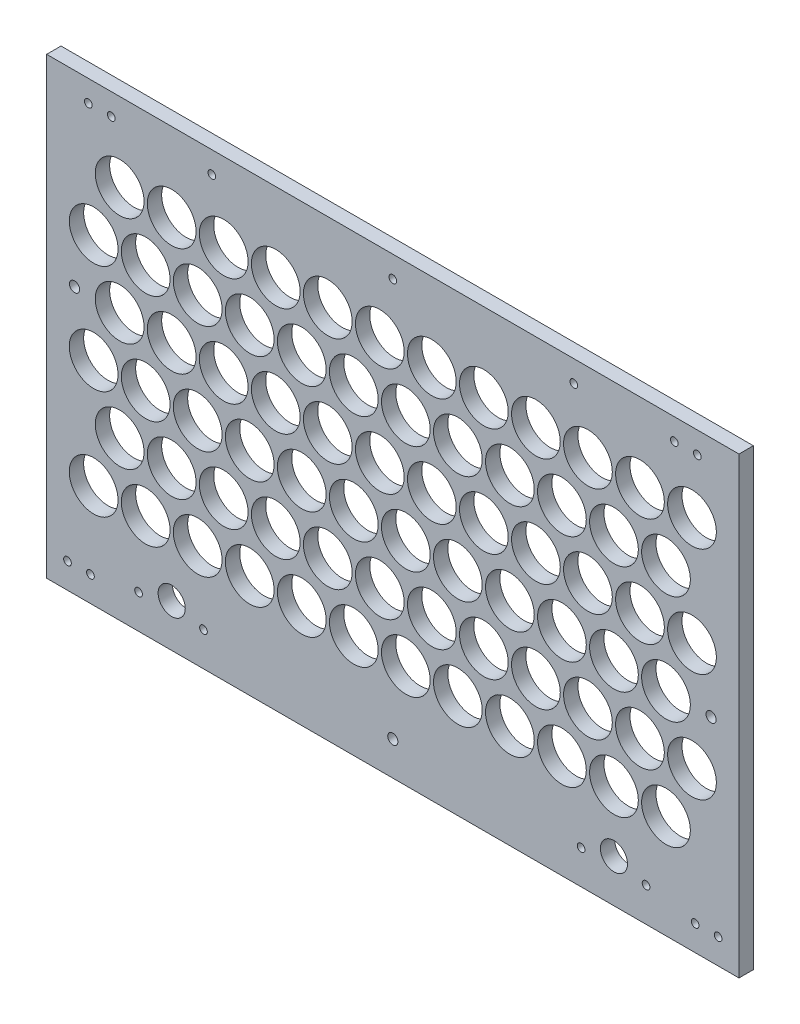
from build123d import *

# Parameters (mm, degrees)
SKETCH1_W                  = 306.05000007
SKETCH1_H                  = 197.4250001
BOSS_EXTRUDE1_DEPTH        = 6.35
SKETCH3_R                  = 10.775
CUT_EXTRUDE1_DEPTH         = 187.132543615
SKETCH4_R                  = 10.775
CUT_EXTRUDE2_DEPTH         = 187.132543615
LPATTERN1_COUNT            = 12
LPATTERN1_PITCH            = 23
LPATTERN2_COUNT            = 3
LPATTERN2_PITCH            = 48
LPATTERN2_COPY_1_SKETCH_R  = 10.775
LPATTERN2_COPY_1_DEPTH     = 187.132543615
LPATTERN2_COPY_2_SKETCH_R  = 10.775
LPATTERN2_COPY_2_DEPTH     = 187.132543615
LPATTERN2_COPY_3_SKETCH_R  = 10.775
LPATTERN2_COPY_3_DEPTH     = 187.132543615
LPATTERN2_COPY_4_SKETCH_R  = 10.775
LPATTERN2_COPY_4_DEPTH     = 187.132543615
LPATTERN2_COPY_5_SKETCH_R  = 10.775
LPATTERN2_COPY_5_DEPTH     = 187.132543615
LPATTERN2_COPY_6_SKETCH_R  = 10.775
LPATTERN2_COPY_6_DEPTH     = 187.132543615
LPATTERN2_COPY_7_SKETCH_R  = 10.775
LPATTERN2_COPY_7_DEPTH     = 187.132543615
LPATTERN2_COPY_8_SKETCH_R  = 10.775
LPATTERN2_COPY_8_DEPTH     = 187.132543615
LPATTERN2_COPY_9_SKETCH_R  = 10.775
LPATTERN2_COPY_9_DEPTH     = 187.132543615
LPATTERN2_COPY_10_SKETCH_R = 10.775
LPATTERN2_COPY_10_DEPTH    = 187.132543615
LPATTERN2_COPY_11_SKETCH_R = 10.775
LPATTERN2_COPY_11_DEPTH    = 187.132543615
LPATTERN2_COPY_12_SKETCH_R = 10.775
LPATTERN2_COPY_12_DEPTH    = 187.132543615
LPATTERN2_COPY_13_SKETCH_R = 10.775
LPATTERN2_COPY_13_DEPTH    = 187.132543615
LPATTERN2_COPY_14_SKETCH_R = 10.775
LPATTERN2_COPY_14_DEPTH    = 187.132543615
LPATTERN2_COPY_15_SKETCH_R = 10.775
LPATTERN2_COPY_15_DEPTH    = 187.132543615
LPATTERN2_COPY_16_SKETCH_R = 10.775
LPATTERN2_COPY_16_DEPTH    = 187.132543615
LPATTERN2_COPY_17_SKETCH_R = 10.775
LPATTERN2_COPY_17_DEPTH    = 187.132543615
LPATTERN2_COPY_18_SKETCH_R = 10.775
LPATTERN2_COPY_18_DEPTH    = 187.132543615
LPATTERN2_COPY_19_SKETCH_R = 10.775
LPATTERN2_COPY_19_DEPTH    = 187.132543615
LPATTERN2_COPY_20_SKETCH_R = 10.775
LPATTERN2_COPY_20_DEPTH    = 187.132543615
LPATTERN2_COPY_21_SKETCH_R = 10.775
LPATTERN2_COPY_21_DEPTH    = 187.132543615
LPATTERN2_COPY_22_SKETCH_R = 10.775
LPATTERN2_COPY_22_DEPTH    = 187.132543615
LPATTERN2_COPY_23_SKETCH_R = 10.775
LPATTERN2_COPY_23_DEPTH    = 187.132543615
LPATTERN2_COPY_24_SKETCH_R = 10.775
LPATTERN2_COPY_24_DEPTH    = 187.132543615
LPATTERN2_COPY_25_SKETCH_R = 10.775
LPATTERN2_COPY_25_DEPTH    = 187.132543615
LPATTERN2_COPY_26_SKETCH_R = 10.775
LPATTERN2_COPY_26_DEPTH    = 187.132543615
LPATTERN2_COPY_27_SKETCH_R = 10.775
LPATTERN2_COPY_27_DEPTH    = 187.132543615
LPATTERN2_COPY_28_SKETCH_R = 10.775
LPATTERN2_COPY_28_DEPTH    = 187.132543615
LPATTERN2_COPY_29_SKETCH_R = 10.775
LPATTERN2_COPY_29_DEPTH    = 187.132543615
LPATTERN2_COPY_30_SKETCH_R = 10.775
LPATTERN2_COPY_30_DEPTH    = 187.132543615
LPATTERN2_COPY_31_SKETCH_R = 10.775
LPATTERN2_COPY_31_DEPTH    = 187.132543615
LPATTERN2_COPY_32_SKETCH_R = 10.775
LPATTERN2_COPY_32_DEPTH    = 187.132543615
LPATTERN2_COPY_33_SKETCH_R = 10.775
LPATTERN2_COPY_33_DEPTH    = 187.132543615
LPATTERN2_COPY_34_SKETCH_R = 10.775
LPATTERN2_COPY_34_DEPTH    = 187.132543615
LPATTERN2_COPY_35_SKETCH_R = 10.775
LPATTERN2_COPY_35_DEPTH    = 187.132543615
LPATTERN2_COPY_36_SKETCH_R = 10.775
LPATTERN2_COPY_36_DEPTH    = 187.132543615
LPATTERN2_COPY_37_SKETCH_R = 10.775
LPATTERN2_COPY_37_DEPTH    = 187.132543615
LPATTERN2_COPY_38_SKETCH_R = 10.775
LPATTERN2_COPY_38_DEPTH    = 187.132543615
LPATTERN2_COPY_39_SKETCH_R = 10.775
LPATTERN2_COPY_39_DEPTH    = 187.132543615
LPATTERN2_COPY_40_SKETCH_R = 10.775
LPATTERN2_COPY_40_DEPTH    = 187.132543615
LPATTERN2_COPY_41_SKETCH_R = 10.775
LPATTERN2_COPY_41_DEPTH    = 187.132543615
LPATTERN2_COPY_42_SKETCH_R = 10.775
LPATTERN2_COPY_42_DEPTH    = 187.132543615
LPATTERN2_COPY_43_SKETCH_R = 10.775
LPATTERN2_COPY_43_DEPTH    = 187.132543615
LPATTERN2_COPY_44_SKETCH_R = 10.775
LPATTERN2_COPY_44_DEPTH    = 187.132543615
SKETCH13_W                 = 306.05000007
SKETCH13_H                 = 6.35
BOSS_EXTRUDE2_DEPTH        = 3.175
SKETCH14_R                 = 6
CUT_EXTRUDE3_DEPTH         = 187.132543615
M3_CLEARANCE_HOLE1_D       = 3.4
SKETCH17_R                 = 2.25
CUT_EXTRUDE4_DEPTH         = 187.132543615


with BuildPart() as part:
    # Sketch1 → Boss-Extrude1 (new body)
    with BuildSketch(Plane.XY):
        with Locations((3.5e-08, -7.06250005)):
            Rectangle(SKETCH1_W, SKETCH1_H)
    extrude(amount=BOSS_EXTRUDE1_DEPTH)

    # Sketch3 → Cut-Extrude1 (cut, through all)
    with BuildSketch(Plane.XY.offset(6.35)):
        with Locations((-132.25, -60)):
            Circle(SKETCH3_R)
    cut_extrude1 = extrude(amount=-CUT_EXTRUDE1_DEPTH, mode=Mode.SUBTRACT)

    # Sketch4 → Cut-Extrude2 (cut, through all)
    with BuildSketch(Plane.XY.offset(6.35)):
        with Locations((-120.75, -36)):
            Circle(SKETCH4_R)
    cut_extrude2 = extrude(amount=-CUT_EXTRUDE2_DEPTH, mode=Mode.SUBTRACT)

    # LPattern1: Cut-Extrude1, Cut-Extrude2 ×12
    with Locations(*[(i * LPATTERN1_PITCH, 0, 0) for i in range(1, LPATTERN1_COUNT)]):
        add(cut_extrude1, mode=Mode.SUBTRACT)
        add(cut_extrude2, mode=Mode.SUBTRACT)

    # LPattern2: Cut-Extrude1, Cut-Extrude2 ×3
    with Locations(*[(0, i * LPATTERN2_PITCH, 0) for i in range(1, LPATTERN2_COUNT)]):
        add(cut_extrude1, mode=Mode.SUBTRACT)
        add(cut_extrude2, mode=Mode.SUBTRACT)

    # LPattern2 copy 1 sketch → LPattern2 copy 1 (cut, through all)
    with BuildSketch(Plane(origin=(23, 48, 6.35), x_dir=(1, 0, 0), z_dir=(0, 0, 1))):
        with Locations((-132.25, -60)):
            Circle(LPATTERN2_COPY_1_SKETCH_R)
    extrude(amount=-LPATTERN2_COPY_1_DEPTH, mode=Mode.SUBTRACT)

    # LPattern2 copy 2 sketch → LPattern2 copy 2 (cut, through all)
    with BuildSketch(Plane(origin=(23, 96, 6.35), x_dir=(1, 0, 0), z_dir=(0, 0, 1))):
        with Locations((-132.25, -60)):
            Circle(LPATTERN2_COPY_2_SKETCH_R)
    extrude(amount=-LPATTERN2_COPY_2_DEPTH, mode=Mode.SUBTRACT)

    # LPattern2 copy 3 sketch → LPattern2 copy 3 (cut, through all)
    with BuildSketch(Plane(origin=(46, 48, 6.35), x_dir=(1, 0, 0), z_dir=(0, 0, 1))):
        with Locations((-132.25, -60)):
            Circle(LPATTERN2_COPY_3_SKETCH_R)
    extrude(amount=-LPATTERN2_COPY_3_DEPTH, mode=Mode.SUBTRACT)

    # LPattern2 copy 4 sketch → LPattern2 copy 4 (cut, through all)
    with BuildSketch(Plane(origin=(46, 96, 6.35), x_dir=(1, 0, 0), z_dir=(0, 0, 1))):
        with Locations((-132.25, -60)):
            Circle(LPATTERN2_COPY_4_SKETCH_R)
    extrude(amount=-LPATTERN2_COPY_4_DEPTH, mode=Mode.SUBTRACT)

    # LPattern2 copy 5 sketch → LPattern2 copy 5 (cut, through all)
    with BuildSketch(Plane(origin=(69, 48, 6.35), x_dir=(1, 0, 0), z_dir=(0, 0, 1))):
        with Locations((-132.25, -60)):
            Circle(LPATTERN2_COPY_5_SKETCH_R)
    extrude(amount=-LPATTERN2_COPY_5_DEPTH, mode=Mode.SUBTRACT)

    # LPattern2 copy 6 sketch → LPattern2 copy 6 (cut, through all)
    with BuildSketch(Plane(origin=(69, 96, 6.35), x_dir=(1, 0, 0), z_dir=(0, 0, 1))):
        with Locations((-132.25, -60)):
            Circle(LPATTERN2_COPY_6_SKETCH_R)
    extrude(amount=-LPATTERN2_COPY_6_DEPTH, mode=Mode.SUBTRACT)

    # LPattern2 copy 7 sketch → LPattern2 copy 7 (cut, through all)
    with BuildSketch(Plane(origin=(92, 48, 6.35), x_dir=(1, 0, 0), z_dir=(0, 0, 1))):
        with Locations((-132.25, -60)):
            Circle(LPATTERN2_COPY_7_SKETCH_R)
    extrude(amount=-LPATTERN2_COPY_7_DEPTH, mode=Mode.SUBTRACT)

    # LPattern2 copy 8 sketch → LPattern2 copy 8 (cut, through all)
    with BuildSketch(Plane(origin=(92, 96, 6.35), x_dir=(1, 0, 0), z_dir=(0, 0, 1))):
        with Locations((-132.25, -60)):
            Circle(LPATTERN2_COPY_8_SKETCH_R)
    extrude(amount=-LPATTERN2_COPY_8_DEPTH, mode=Mode.SUBTRACT)

    # LPattern2 copy 9 sketch → LPattern2 copy 9 (cut, through all)
    with BuildSketch(Plane(origin=(115, 48, 6.35), x_dir=(1, 0, 0), z_dir=(0, 0, 1))):
        with Locations((-132.25, -60)):
            Circle(LPATTERN2_COPY_9_SKETCH_R)
    extrude(amount=-LPATTERN2_COPY_9_DEPTH, mode=Mode.SUBTRACT)

    # LPattern2 copy 10 sketch → LPattern2 copy 10 (cut, through all)
    with BuildSketch(Plane(origin=(115, 96, 6.35), x_dir=(1, 0, 0), z_dir=(0, 0, 1))):
        with Locations((-132.25, -60)):
            Circle(LPATTERN2_COPY_10_SKETCH_R)
    extrude(amount=-LPATTERN2_COPY_10_DEPTH, mode=Mode.SUBTRACT)

    # LPattern2 copy 11 sketch → LPattern2 copy 11 (cut, through all)
    with BuildSketch(Plane(origin=(138, 48, 6.35), x_dir=(1, 0, 0), z_dir=(0, 0, 1))):
        with Locations((-132.25, -60)):
            Circle(LPATTERN2_COPY_11_SKETCH_R)
    extrude(amount=-LPATTERN2_COPY_11_DEPTH, mode=Mode.SUBTRACT)

    # LPattern2 copy 12 sketch → LPattern2 copy 12 (cut, through all)
    with BuildSketch(Plane(origin=(138, 96, 6.35), x_dir=(1, 0, 0), z_dir=(0, 0, 1))):
        with Locations((-132.25, -60)):
            Circle(LPATTERN2_COPY_12_SKETCH_R)
    extrude(amount=-LPATTERN2_COPY_12_DEPTH, mode=Mode.SUBTRACT)

    # LPattern2 copy 13 sketch → LPattern2 copy 13 (cut, through all)
    with BuildSketch(Plane(origin=(161, 48, 6.35), x_dir=(1, 0, 0), z_dir=(0, 0, 1))):
        with Locations((-132.25, -60)):
            Circle(LPATTERN2_COPY_13_SKETCH_R)
    extrude(amount=-LPATTERN2_COPY_13_DEPTH, mode=Mode.SUBTRACT)

    # LPattern2 copy 14 sketch → LPattern2 copy 14 (cut, through all)
    with BuildSketch(Plane(origin=(161, 96, 6.35), x_dir=(1, 0, 0), z_dir=(0, 0, 1))):
        with Locations((-132.25, -60)):
            Circle(LPATTERN2_COPY_14_SKETCH_R)
    extrude(amount=-LPATTERN2_COPY_14_DEPTH, mode=Mode.SUBTRACT)

    # LPattern2 copy 15 sketch → LPattern2 copy 15 (cut, through all)
    with BuildSketch(Plane(origin=(184, 48, 6.35), x_dir=(1, 0, 0), z_dir=(0, 0, 1))):
        with Locations((-132.25, -60)):
            Circle(LPATTERN2_COPY_15_SKETCH_R)
    extrude(amount=-LPATTERN2_COPY_15_DEPTH, mode=Mode.SUBTRACT)

    # LPattern2 copy 16 sketch → LPattern2 copy 16 (cut, through all)
    with BuildSketch(Plane(origin=(184, 96, 6.35), x_dir=(1, 0, 0), z_dir=(0, 0, 1))):
        with Locations((-132.25, -60)):
            Circle(LPATTERN2_COPY_16_SKETCH_R)
    extrude(amount=-LPATTERN2_COPY_16_DEPTH, mode=Mode.SUBTRACT)

    # LPattern2 copy 17 sketch → LPattern2 copy 17 (cut, through all)
    with BuildSketch(Plane(origin=(207, 48, 6.35), x_dir=(1, 0, 0), z_dir=(0, 0, 1))):
        with Locations((-132.25, -60)):
            Circle(LPATTERN2_COPY_17_SKETCH_R)
    extrude(amount=-LPATTERN2_COPY_17_DEPTH, mode=Mode.SUBTRACT)

    # LPattern2 copy 18 sketch → LPattern2 copy 18 (cut, through all)
    with BuildSketch(Plane(origin=(207, 96, 6.35), x_dir=(1, 0, 0), z_dir=(0, 0, 1))):
        with Locations((-132.25, -60)):
            Circle(LPATTERN2_COPY_18_SKETCH_R)
    extrude(amount=-LPATTERN2_COPY_18_DEPTH, mode=Mode.SUBTRACT)

    # LPattern2 copy 19 sketch → LPattern2 copy 19 (cut, through all)
    with BuildSketch(Plane(origin=(230, 48, 6.35), x_dir=(1, 0, 0), z_dir=(0, 0, 1))):
        with Locations((-132.25, -60)):
            Circle(LPATTERN2_COPY_19_SKETCH_R)
    extrude(amount=-LPATTERN2_COPY_19_DEPTH, mode=Mode.SUBTRACT)

    # LPattern2 copy 20 sketch → LPattern2 copy 20 (cut, through all)
    with BuildSketch(Plane(origin=(230, 96, 6.35), x_dir=(1, 0, 0), z_dir=(0, 0, 1))):
        with Locations((-132.25, -60)):
            Circle(LPATTERN2_COPY_20_SKETCH_R)
    extrude(amount=-LPATTERN2_COPY_20_DEPTH, mode=Mode.SUBTRACT)

    # LPattern2 copy 21 sketch → LPattern2 copy 21 (cut, through all)
    with BuildSketch(Plane(origin=(253, 48, 6.35), x_dir=(1, 0, 0), z_dir=(0, 0, 1))):
        with Locations((-132.25, -60)):
            Circle(LPATTERN2_COPY_21_SKETCH_R)
    extrude(amount=-LPATTERN2_COPY_21_DEPTH, mode=Mode.SUBTRACT)

    # LPattern2 copy 22 sketch → LPattern2 copy 22 (cut, through all)
    with BuildSketch(Plane(origin=(253, 96, 6.35), x_dir=(1, 0, 0), z_dir=(0, 0, 1))):
        with Locations((-132.25, -60)):
            Circle(LPATTERN2_COPY_22_SKETCH_R)
    extrude(amount=-LPATTERN2_COPY_22_DEPTH, mode=Mode.SUBTRACT)

    # LPattern2 copy 23 sketch → LPattern2 copy 23 (cut, through all)
    with BuildSketch(Plane(origin=(23, 48, 6.35), x_dir=(1, 0, 0), z_dir=(0, 0, 1))):
        with Locations((-120.75, -36)):
            Circle(LPATTERN2_COPY_23_SKETCH_R)
    extrude(amount=-LPATTERN2_COPY_23_DEPTH, mode=Mode.SUBTRACT)

    # LPattern2 copy 24 sketch → LPattern2 copy 24 (cut, through all)
    with BuildSketch(Plane(origin=(23, 96, 6.35), x_dir=(1, 0, 0), z_dir=(0, 0, 1))):
        with Locations((-120.75, -36)):
            Circle(LPATTERN2_COPY_24_SKETCH_R)
    extrude(amount=-LPATTERN2_COPY_24_DEPTH, mode=Mode.SUBTRACT)

    # LPattern2 copy 25 sketch → LPattern2 copy 25 (cut, through all)
    with BuildSketch(Plane(origin=(46, 48, 6.35), x_dir=(1, 0, 0), z_dir=(0, 0, 1))):
        with Locations((-120.75, -36)):
            Circle(LPATTERN2_COPY_25_SKETCH_R)
    extrude(amount=-LPATTERN2_COPY_25_DEPTH, mode=Mode.SUBTRACT)

    # LPattern2 copy 26 sketch → LPattern2 copy 26 (cut, through all)
    with BuildSketch(Plane(origin=(46, 96, 6.35), x_dir=(1, 0, 0), z_dir=(0, 0, 1))):
        with Locations((-120.75, -36)):
            Circle(LPATTERN2_COPY_26_SKETCH_R)
    extrude(amount=-LPATTERN2_COPY_26_DEPTH, mode=Mode.SUBTRACT)

    # LPattern2 copy 27 sketch → LPattern2 copy 27 (cut, through all)
    with BuildSketch(Plane(origin=(69, 48, 6.35), x_dir=(1, 0, 0), z_dir=(0, 0, 1))):
        with Locations((-120.75, -36)):
            Circle(LPATTERN2_COPY_27_SKETCH_R)
    extrude(amount=-LPATTERN2_COPY_27_DEPTH, mode=Mode.SUBTRACT)

    # LPattern2 copy 28 sketch → LPattern2 copy 28 (cut, through all)
    with BuildSketch(Plane(origin=(69, 96, 6.35), x_dir=(1, 0, 0), z_dir=(0, 0, 1))):
        with Locations((-120.75, -36)):
            Circle(LPATTERN2_COPY_28_SKETCH_R)
    extrude(amount=-LPATTERN2_COPY_28_DEPTH, mode=Mode.SUBTRACT)

    # LPattern2 copy 29 sketch → LPattern2 copy 29 (cut, through all)
    with BuildSketch(Plane(origin=(92, 48, 6.35), x_dir=(1, 0, 0), z_dir=(0, 0, 1))):
        with Locations((-120.75, -36)):
            Circle(LPATTERN2_COPY_29_SKETCH_R)
    extrude(amount=-LPATTERN2_COPY_29_DEPTH, mode=Mode.SUBTRACT)

    # LPattern2 copy 30 sketch → LPattern2 copy 30 (cut, through all)
    with BuildSketch(Plane(origin=(92, 96, 6.35), x_dir=(1, 0, 0), z_dir=(0, 0, 1))):
        with Locations((-120.75, -36)):
            Circle(LPATTERN2_COPY_30_SKETCH_R)
    extrude(amount=-LPATTERN2_COPY_30_DEPTH, mode=Mode.SUBTRACT)

    # LPattern2 copy 31 sketch → LPattern2 copy 31 (cut, through all)
    with BuildSketch(Plane(origin=(115, 48, 6.35), x_dir=(1, 0, 0), z_dir=(0, 0, 1))):
        with Locations((-120.75, -36)):
            Circle(LPATTERN2_COPY_31_SKETCH_R)
    extrude(amount=-LPATTERN2_COPY_31_DEPTH, mode=Mode.SUBTRACT)

    # LPattern2 copy 32 sketch → LPattern2 copy 32 (cut, through all)
    with BuildSketch(Plane(origin=(115, 96, 6.35), x_dir=(1, 0, 0), z_dir=(0, 0, 1))):
        with Locations((-120.75, -36)):
            Circle(LPATTERN2_COPY_32_SKETCH_R)
    extrude(amount=-LPATTERN2_COPY_32_DEPTH, mode=Mode.SUBTRACT)

    # LPattern2 copy 33 sketch → LPattern2 copy 33 (cut, through all)
    with BuildSketch(Plane(origin=(138, 48, 6.35), x_dir=(1, 0, 0), z_dir=(0, 0, 1))):
        with Locations((-120.75, -36)):
            Circle(LPATTERN2_COPY_33_SKETCH_R)
    extrude(amount=-LPATTERN2_COPY_33_DEPTH, mode=Mode.SUBTRACT)

    # LPattern2 copy 34 sketch → LPattern2 copy 34 (cut, through all)
    with BuildSketch(Plane(origin=(138, 96, 6.35), x_dir=(1, 0, 0), z_dir=(0, 0, 1))):
        with Locations((-120.75, -36)):
            Circle(LPATTERN2_COPY_34_SKETCH_R)
    extrude(amount=-LPATTERN2_COPY_34_DEPTH, mode=Mode.SUBTRACT)

    # LPattern2 copy 35 sketch → LPattern2 copy 35 (cut, through all)
    with BuildSketch(Plane(origin=(161, 48, 6.35), x_dir=(1, 0, 0), z_dir=(0, 0, 1))):
        with Locations((-120.75, -36)):
            Circle(LPATTERN2_COPY_35_SKETCH_R)
    extrude(amount=-LPATTERN2_COPY_35_DEPTH, mode=Mode.SUBTRACT)

    # LPattern2 copy 36 sketch → LPattern2 copy 36 (cut, through all)
    with BuildSketch(Plane(origin=(161, 96, 6.35), x_dir=(1, 0, 0), z_dir=(0, 0, 1))):
        with Locations((-120.75, -36)):
            Circle(LPATTERN2_COPY_36_SKETCH_R)
    extrude(amount=-LPATTERN2_COPY_36_DEPTH, mode=Mode.SUBTRACT)

    # LPattern2 copy 37 sketch → LPattern2 copy 37 (cut, through all)
    with BuildSketch(Plane(origin=(184, 48, 6.35), x_dir=(1, 0, 0), z_dir=(0, 0, 1))):
        with Locations((-120.75, -36)):
            Circle(LPATTERN2_COPY_37_SKETCH_R)
    extrude(amount=-LPATTERN2_COPY_37_DEPTH, mode=Mode.SUBTRACT)

    # LPattern2 copy 38 sketch → LPattern2 copy 38 (cut, through all)
    with BuildSketch(Plane(origin=(184, 96, 6.35), x_dir=(1, 0, 0), z_dir=(0, 0, 1))):
        with Locations((-120.75, -36)):
            Circle(LPATTERN2_COPY_38_SKETCH_R)
    extrude(amount=-LPATTERN2_COPY_38_DEPTH, mode=Mode.SUBTRACT)

    # LPattern2 copy 39 sketch → LPattern2 copy 39 (cut, through all)
    with BuildSketch(Plane(origin=(207, 48, 6.35), x_dir=(1, 0, 0), z_dir=(0, 0, 1))):
        with Locations((-120.75, -36)):
            Circle(LPATTERN2_COPY_39_SKETCH_R)
    extrude(amount=-LPATTERN2_COPY_39_DEPTH, mode=Mode.SUBTRACT)

    # LPattern2 copy 40 sketch → LPattern2 copy 40 (cut, through all)
    with BuildSketch(Plane(origin=(207, 96, 6.35), x_dir=(1, 0, 0), z_dir=(0, 0, 1))):
        with Locations((-120.75, -36)):
            Circle(LPATTERN2_COPY_40_SKETCH_R)
    extrude(amount=-LPATTERN2_COPY_40_DEPTH, mode=Mode.SUBTRACT)

    # LPattern2 copy 41 sketch → LPattern2 copy 41 (cut, through all)
    with BuildSketch(Plane(origin=(230, 48, 6.35), x_dir=(1, 0, 0), z_dir=(0, 0, 1))):
        with Locations((-120.75, -36)):
            Circle(LPATTERN2_COPY_41_SKETCH_R)
    extrude(amount=-LPATTERN2_COPY_41_DEPTH, mode=Mode.SUBTRACT)

    # LPattern2 copy 42 sketch → LPattern2 copy 42 (cut, through all)
    with BuildSketch(Plane(origin=(230, 96, 6.35), x_dir=(1, 0, 0), z_dir=(0, 0, 1))):
        with Locations((-120.75, -36)):
            Circle(LPATTERN2_COPY_42_SKETCH_R)
    extrude(amount=-LPATTERN2_COPY_42_DEPTH, mode=Mode.SUBTRACT)

    # LPattern2 copy 43 sketch → LPattern2 copy 43 (cut, through all)
    with BuildSketch(Plane(origin=(253, 48, 6.35), x_dir=(1, 0, 0), z_dir=(0, 0, 1))):
        with Locations((-120.75, -36)):
            Circle(LPATTERN2_COPY_43_SKETCH_R)
    extrude(amount=-LPATTERN2_COPY_43_DEPTH, mode=Mode.SUBTRACT)

    # LPattern2 copy 44 sketch → LPattern2 copy 44 (cut, through all)
    with BuildSketch(Plane(origin=(253, 96, 6.35), x_dir=(1, 0, 0), z_dir=(0, 0, 1))):
        with Locations((-120.75, -36)):
            Circle(LPATTERN2_COPY_44_SKETCH_R)
    extrude(amount=-LPATTERN2_COPY_44_DEPTH, mode=Mode.SUBTRACT)

    # Sketch13 → Boss-Extrude2 (add)
    with BuildSketch(Plane(origin=(0, 91.65, 0), x_dir=(1, 0, 0), z_dir=(0, 1, 0))):
        with Locations((3.5e-08, -3.175)):
            Rectangle(SKETCH13_W, SKETCH13_H)
    extrude(amount=BOSS_EXTRUDE2_DEPTH)

    # Sketch14 → Cut-Extrude3 (cut, through all)
    with BuildSketch(Plane(origin=(0, 0, 0), x_dir=(-1, 0, 0), z_dir=(0, 0, -1))):
        with Locations((-97.75, -86.7750001)):
            Circle(SKETCH14_R)
    cut_extrude3 = extrude(amount=-CUT_EXTRUDE3_DEPTH, mode=Mode.SUBTRACT)

    # Mirror1: Cut-Extrude3 across plane
    add(cut_extrude3.mirror(Plane(origin=(0, 0, 0), x_dir=(0, 0, 1), z_dir=(1, 0, 0))), mode=Mode.SUBTRACT)

    # M3 Clearance Hole1 (through all)
    with Locations(Plane(origin=(0, 0, 0), x_dir=(-1, 0, 0), z_dir=(0, 0, -1))):
        with Locations((-111.94, -90.775), (-83.25, -90.775), (83.712, -90.775), (134.610000066, 85.3), (124.450000066, 85.3), (80, 85.3), (0, 85.3), (-80, 85.3), (-124.450000066, 85.3), (-134.610000066, 85.3), (143.817500066, -94.6000001), (133.657500066, -94.6000001), (-133.657500066, -94.6000001), (-143.817500066, -94.6000001), (112.402, -90.775)):
            Hole(M3_CLEARANCE_HOLE1_D / 2)

    # Sketch17 → Cut-Extrude4 (cut, through all)
    with BuildSketch(Plane(origin=(0, 0, 0), x_dir=(-1, 0, 0), z_dir=(0, 0, -1))):
        with Locations((0, -90.775)):
            Circle(SKETCH17_R)
        with Locations((140.687500033, 12)):
            Circle(SKETCH17_R)
        with Locations((-140.687500033, -12)):
            Circle(SKETCH17_R)
    extrude(amount=-CUT_EXTRUDE4_DEPTH, mode=Mode.SUBTRACT)


solid = part.part
